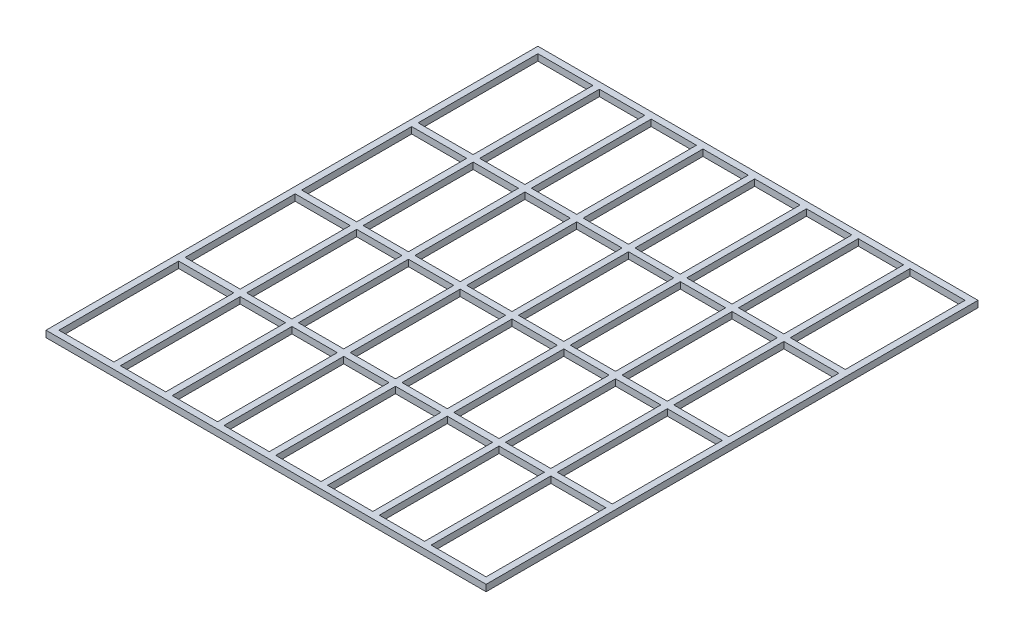
from build123d import *

# Parameters (mm, degrees)
SKETCH1_W           = 2590.8
SKETCH1_H           = 2895.6
SKETCH1_W_2         = 2514.6
SKETCH1_H_2         = 2819.4
BOSS_EXTRUDE1_DEPTH = 38.1
SKETCH2_W           = 38.1
SKETCH2_H           = 2895.6
BOSS_EXTRUDE2_DEPTH = 38.1
LPATTERN1_COUNT     = 4
LPATTERN1_PITCH     = 304.8
LPATTERN2_COUNT     = 4
LPATTERN2_PITCH     = 304.8
SKETCH3_W           = 2590.8
SKETCH3_H           = 38.1
BOSS_EXTRUDE3_DEPTH = 38.1
LPATTERN3_COUNT     = 2
LPATTERN3_PITCH     = 685.8
LPATTERN4_COUNT     = 2
LPATTERN4_PITCH     = 685.8


with BuildPart() as part:
    # Sketch1 → Boss-Extrude1 (new body)
    with BuildSketch(Plane(origin=(0, 0, 0), x_dir=(1, 0, 0), z_dir=(0, 1, 0))):
        Rectangle(SKETCH1_W, SKETCH1_H)
        Rectangle(SKETCH1_W_2, SKETCH1_H_2, mode=Mode.SUBTRACT)
    extrude(amount=BOSS_EXTRUDE1_DEPTH)

    # Sketch2 → Boss-Extrude2 (add)
    with BuildSketch(Plane(origin=(0, 38.1, 0), x_dir=(1, 0, 0), z_dir=(0, 1, 0))):
        Rectangle(SKETCH2_W, SKETCH2_H)
    boss_extrude2 = extrude(amount=-BOSS_EXTRUDE2_DEPTH)

    # LPattern1: Boss-Extrude2 ×4
    with Locations(*[(-i * LPATTERN1_PITCH, 0, 0) for i in range(1, LPATTERN1_COUNT)]):
        add(boss_extrude2)

    # LPattern2: Boss-Extrude2 ×4
    with Locations(*[(i * LPATTERN2_PITCH, 0, 0) for i in range(1, LPATTERN2_COUNT)]):
        add(boss_extrude2)

    # Sketch3 → Boss-Extrude3 (add)
    with BuildSketch(Plane(origin=(0, 38.1, 0), x_dir=(1, 0, 0), z_dir=(0, 1, 0))):
        Rectangle(SKETCH3_W, SKETCH3_H)
    boss_extrude3 = extrude(amount=-BOSS_EXTRUDE3_DEPTH)

    # LPattern3: Boss-Extrude3 ×2
    with Locations(*[(0, 0, i * LPATTERN3_PITCH) for i in range(1, LPATTERN3_COUNT)]):
        add(boss_extrude3)

    # LPattern4: Boss-Extrude3 ×2
    with Locations(*[(0, 0, -i * LPATTERN4_PITCH) for i in range(1, LPATTERN4_COUNT)]):
        add(boss_extrude3)


solid = part.part
